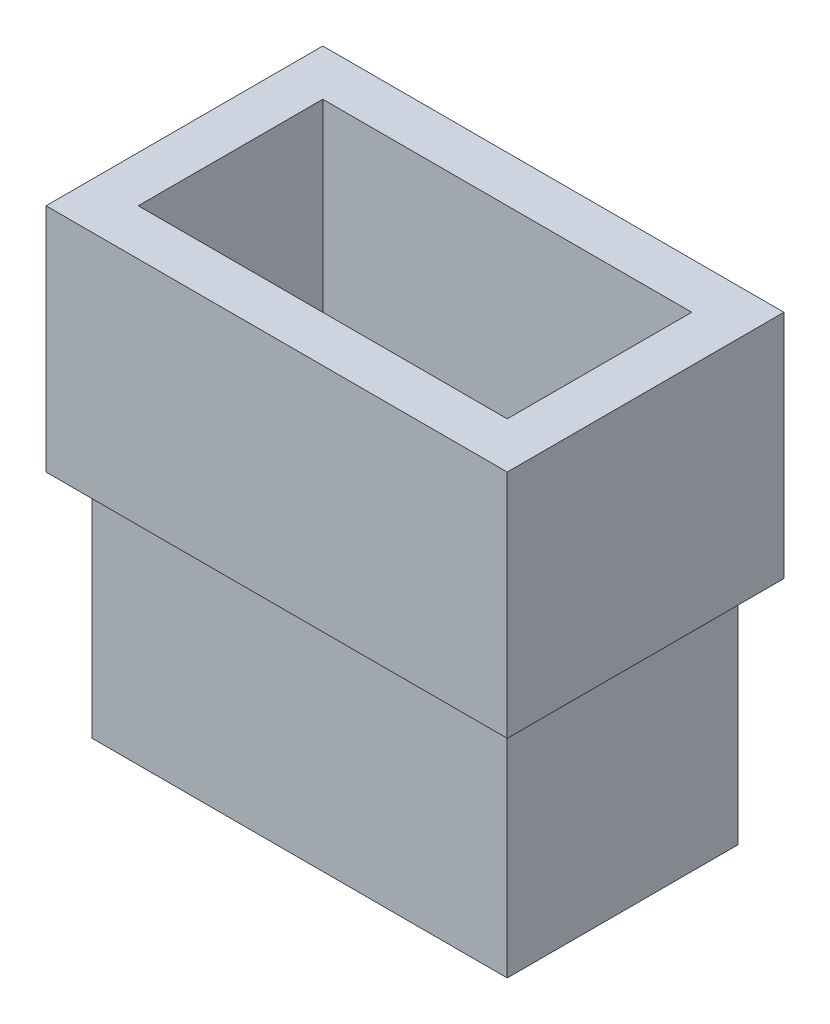
from build123d import *

# Parameters (mm, degrees)
SKETCH1_W           = 50
SKETCH1_H           = 30
SKETCH1_W_2         = 40
SKETCH1_H_2         = 20
BOSS_EXTRUDE1_DEPTH = 25
SKETCH1_3_W         = 45
SKETCH1_3_H         = 25
SKETCH1_3_W_2       = 40
SKETCH1_3_H_2       = 20
BOSS_EXTRUDE2_DEPTH = 25


with BuildPart() as part:
    # Sketch1 → Boss-Extrude1 (new body)
    with BuildSketch(Plane(origin=(0, 0, 0), x_dir=(1, 0, 0), z_dir=(0, 1, 0))):
        Rectangle(SKETCH1_W, SKETCH1_H)
        Rectangle(SKETCH1_W_2, SKETCH1_H_2, mode=Mode.SUBTRACT)
    extrude(amount=BOSS_EXTRUDE1_DEPTH)

    # Sketch1<3> → Boss-Extrude2 (add)
    with BuildSketch(Plane(origin=(0, 0, 0), x_dir=(1, 0, 0), z_dir=(0, 1, 0))):
        Rectangle(SKETCH1_3_W, SKETCH1_3_H)
        Rectangle(SKETCH1_3_W_2, SKETCH1_3_H_2, mode=Mode.SUBTRACT)
    extrude(amount=-BOSS_EXTRUDE2_DEPTH)


solid = part.part
